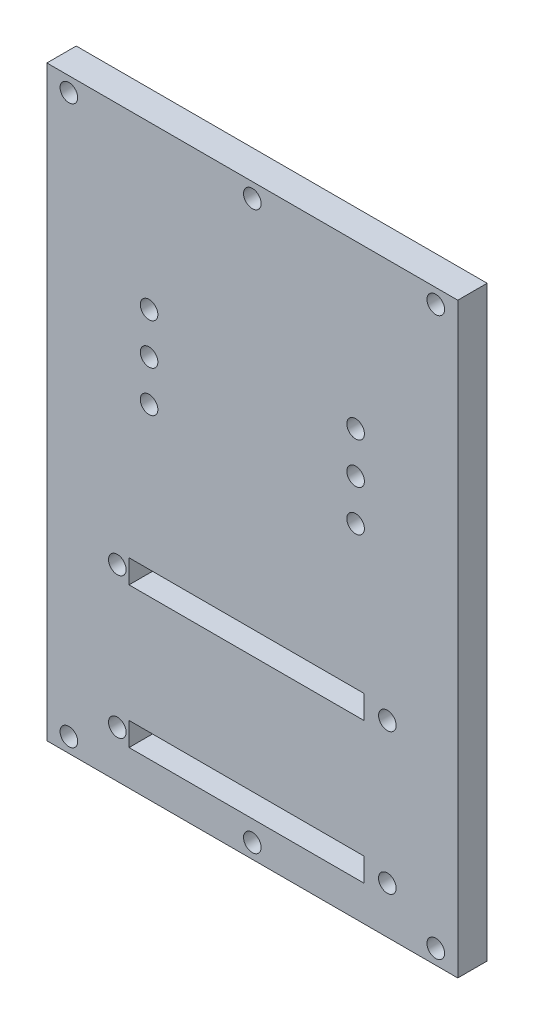
from build123d import *

# Parameters (mm, degrees)
SKETCH1_W           = 70
SKETCH1_H           = 100
BOSS_EXTRUDE1_DEPTH = 2.5
SKETCH2_R           = 1.5
CUT_EXTRUDE1_DEPTH  = 11
SKETCH3_R           = 1.5
SKETCH3_W           = 40
SKETCH3_H           = 4
CUT_EXTRUDE2_DEPTH  = 10


with BuildPart() as part:
    # Sketch1 → Boss-Extrude1 (new, symmetric)
    with BuildSketch(Plane.XY):
        Rectangle(SKETCH1_W, SKETCH1_H)
    extrude(amount=BOSS_EXTRUDE1_DEPTH, both=True)

    # Sketch2 → Cut-Extrude1 (cut)
    with BuildSketch(Plane.XY.offset(2.5)):
        with Locations((0, 47.5)):
            Circle(SKETCH2_R)
        with Locations((-31.25, 47.5)):
            Circle(SKETCH2_R)
        with Locations(Location((31.25, 47.5, 0), (0, 0, 180))):
            Circle(SKETCH2_R)
    cut_extrude1 = extrude(amount=-CUT_EXTRUDE1_DEPTH, mode=Mode.SUBTRACT)

    # Mirror1: Cut-Extrude1 across plane
    add(cut_extrude1.mirror(Plane.ZX), mode=Mode.SUBTRACT)

    # Sketch3 → Cut-Extrude2 (cut)
    with BuildSketch(Plane.XY.offset(2.5)):
        with Locations((-17.594978519, 15.321286244)):
            Circle(SKETCH3_R)
        with Locations((-17.594978519, 22.321286244)):
            Circle(SKETCH3_R)
        with Locations((-17.594978519, 8.321286244)):
            Circle(SKETCH3_R)
        with Locations(Location((17.594978519, 8.321286244, 0), (0, 0, 180))):
            Circle(SKETCH3_R)
        with Locations(Location((17.594978519, 15.321286244, 0), (0, 0, 180))):
            Circle(SKETCH3_R)
        with Locations(Location((17.594978519, 22.321286244, 0), (0, 0, 180))):
            Circle(SKETCH3_R)
        with Locations((-23, -18)):
            Circle(SKETCH3_R)
        with Locations(Location((23, -18, 0), (0, 0, 180))):
            Circle(SKETCH3_R)
        with Locations((23, -42)):
            Circle(SKETCH3_R)
        with Locations(Location((-23, -42, 0), (0, 0, 180))):
            Circle(SKETCH3_R)
        with Locations((-1, -42)):
            Rectangle(SKETCH3_W, SKETCH3_H)
        with Locations((-1, -18)):
            Rectangle(SKETCH3_W, SKETCH3_H)
    extrude(amount=-CUT_EXTRUDE2_DEPTH, mode=Mode.SUBTRACT)


solid = part.part
